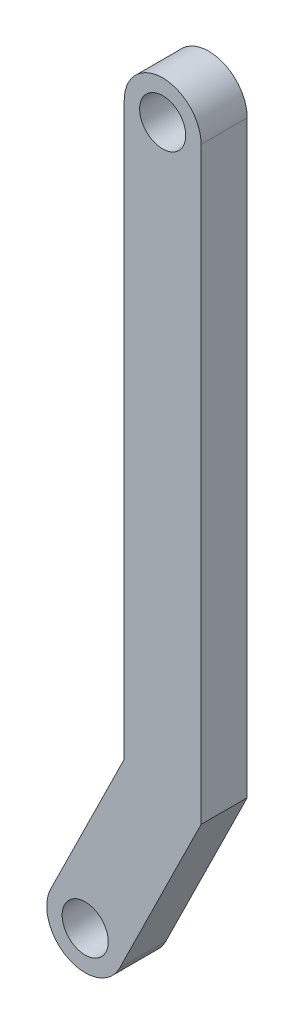
from build123d import *

# Parameters (mm, degrees)
SKETCH1_R           = 15
BOSS_EXTRUDE1_DEPTH = 30


with BuildPart() as part:
    # Sketch1 → Boss-Extrude1 (new body)
    with BuildSketch(Plane.XY):
        with BuildLine():
            Line((-61.054066009, 459.688422397), (-61.054066009, 88.319905145))
            Line((-61.054066009, 88.319905145), (-108.868464608, -8.595458486))
            ThreePointArc((-108.868464608, -8.595458486), (-97.509706692, -42.076477267), (-64.028687911, -30.717719351))
            Line((-64.028687911, -30.717719351), (-11.054066009, 76.656939649))
            Line((-11.054066009, 76.656939649), (-11.054066009, 459.688422397))
            ThreePointArc((-11.054066009, 459.688422397), (-36.054066009, 484.688422397), (-61.054066009, 459.688422397))
        make_face()
        with Locations((-36.054066009, 459.688422397)):
            Circle(SKETCH1_R, mode=Mode.SUBTRACT)
        with Locations((-86.44857626, -19.656588918)):
            Circle(SKETCH1_R, mode=Mode.SUBTRACT)
    extrude(amount=BOSS_EXTRUDE1_DEPTH)


solid = part.part
